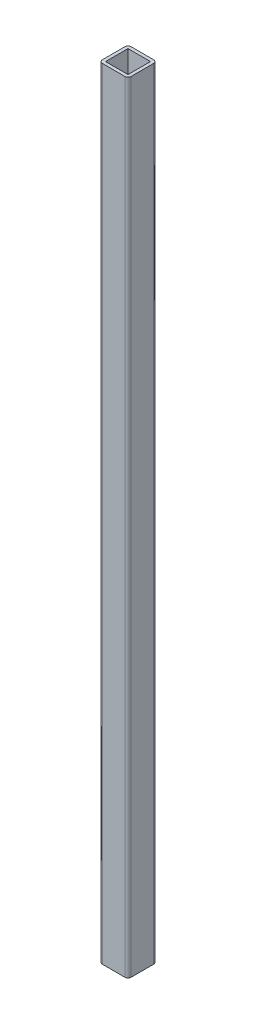
from build123d import *

# Parameters (mm, degrees)
BOSS_EXTRUDE1_DEPTH = 693
SKETCH3_W           = 20
SKETCH3_H           = 20
CUT_EXTRUDE1_DEPTH  = 693


with BuildPart() as part:
    # Sketch1 → Boss-Extrude1 (new body)
    with BuildSketch(Plane(origin=(0, 0, 0), x_dir=(1, 0, 0), z_dir=(0, 1, 0))):
        with BuildLine():
            Line((2.8, 0), (22.8, 0))
            ThreePointArc((22.8, 0), (24.779898987, -0.820101013), (25.6, -2.8))
            Line((25.6, -2.8), (25.6, -22.8))
            ThreePointArc((25.6, -22.8), (24.779898987, -24.779898987), (22.8, -25.6))
            Line((22.8, -25.6), (2.8, -25.6))
            ThreePointArc((2.8, -25.6), (0.820101013, -24.779898987), (0, -22.8))
            Line((0, -22.8), (0, -2.8))
            ThreePointArc((0, -2.8), (0.820101013, -0.820101013), (2.8, 0))
        make_face()
    extrude(amount=BOSS_EXTRUDE1_DEPTH)

    # Sketch3 → Cut-Extrude1 (cut)
    with BuildSketch(Plane(origin=(0, 0, 0), x_dir=(-1, 0, 0), z_dir=(0, -1, 0))):
        with Locations((-12.8, -12.8)):
            Rectangle(SKETCH3_W, SKETCH3_H)
    extrude(amount=-CUT_EXTRUDE1_DEPTH, mode=Mode.SUBTRACT)


solid = part.part
